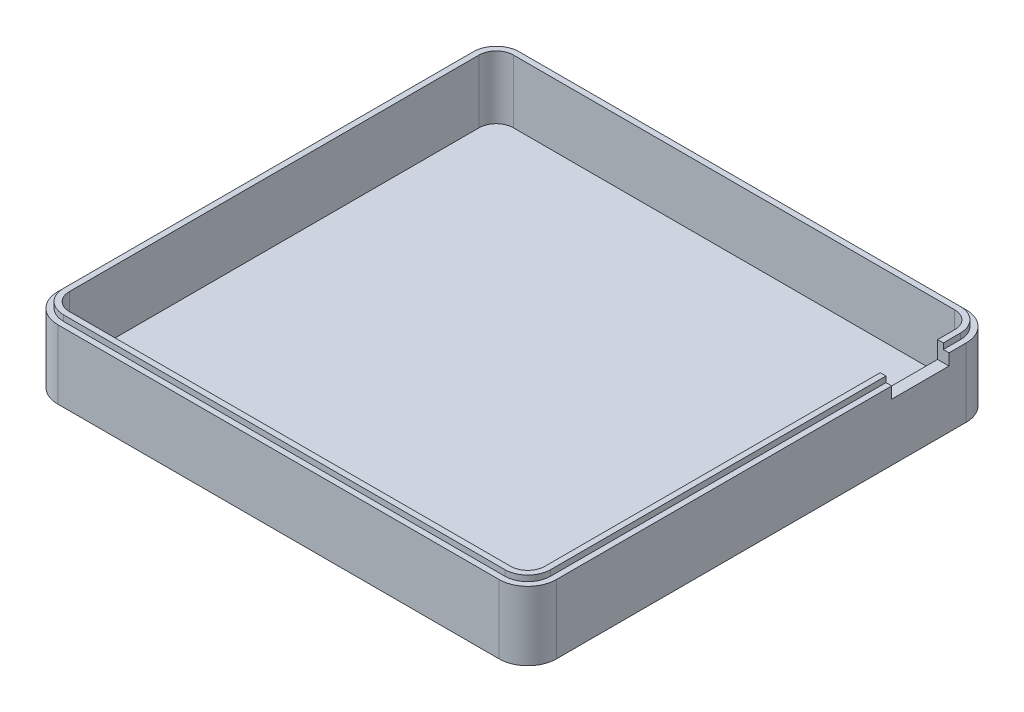
from build123d import *

# Parameters (mm, degrees)
EXTRUDE_4_DEPTH     = 2
EXTRUDE_5_DEPTH     = 12
EXTRUDE_START       = -12
EXTRUDE_7_DEPTH     = 1
CUT_EXTRUDE_START   = 2
CUT_EXTRUDE_4_DEPTH = 11
CUT_EXTRUDE_5_REACH = 119.533
SKETCH_4_W          = 10
SKETCH_4_H          = 5


with BuildPart() as part:
    # Эскиз1 → Бобышка-Вытянуть4 (new body)
    with BuildSketch(Plane(origin=(0, 0, 0), x_dir=(1, 0, 0), z_dir=(0, 1, 0))):
        with BuildLine():
            Line((-2.084374602, -1.449446306), (-2.084374602, -72.949446306))
            ThreePointArc((-2.084374602, -72.949446306), (-0.619908508, -76.484980212), (2.915625398, -77.949446306))
            Line((2.915625398, -77.949446306), (79.915625398, -77.949446306))
            ThreePointArc((79.915625398, -77.949446306), (83.451159304, -76.484980212), (84.915625398, -72.949446306))
            Line((84.915625398, -72.949446306), (84.915625398, -1.449446306))
            ThreePointArc((84.915625398, -1.449446306), (83.451159304, 2.0860876), (79.915625398, 3.550553694))
            Line((79.915625398, 3.550553694), (2.915625398, 3.550553694))
            ThreePointArc((2.915625398, 3.550553694), (-0.619908508, 2.0860876), (-2.084374602, -1.449446306))
        make_face()
    extrude(amount=EXTRUDE_4_DEPTH)

    # Эскиз1<9> → Бобышка-Вытянуть5 (add)
    with BuildSketch(Plane(origin=(0, 0, 0), x_dir=(1, 0, 0), z_dir=(0, 1, 0))):
        with BuildLine():
            Line((-2.084374602, -1.449446306), (-2.084374602, -72.949446306))
            ThreePointArc((-2.084374602, -72.949446306), (-0.619908508, -76.484980212), (2.915625398, -77.949446306))
            Line((2.915625398, -77.949446306), (79.915625398, -77.949446306))
            ThreePointArc((79.915625398, -77.949446306), (83.451159304, -76.484980212), (84.915625398, -72.949446306))
            Line((84.915625398, -72.949446306), (84.915625398, -1.449446306))
            ThreePointArc((84.915625398, -1.449446306), (83.451159304, 2.0860876), (79.915625398, 3.550553694))
            Line((79.915625398, 3.550553694), (2.915625398, 3.550553694))
            ThreePointArc((2.915625398, 3.550553694), (-0.619908508, 2.0860876), (-2.084374602, -1.449446306))
        make_face()
        with BuildLine():
            Line((-0.084374602, -1.449446306), (-0.084374602, -72.949446306))
            ThreePointArc((-0.084374602, -72.949446306), (0.794305055, -75.070766649), (2.915625398, -75.949446306))
            Line((2.915625398, -75.949446306), (79.915625398, -75.949446306))
            ThreePointArc((79.915625398, -75.949446306), (82.036945742, -75.070766649), (82.915625398, -72.949446306))
            Line((82.915625398, -72.949446306), (82.915625398, -1.449446306))
            ThreePointArc((82.915625398, -1.449446306), (82.036945742, 0.671874038), (79.915625398, 1.550553694))
            Line((79.915625398, 1.550553694), (2.915625398, 1.550553694))
            ThreePointArc((2.915625398, 1.550553694), (0.794305055, 0.671874038), (-0.084374602, -1.449446306))
        make_face(mode=Mode.SUBTRACT)
    extrude(amount=EXTRUDE_5_DEPTH)

    # Эскиз3 → Бобышка-Вытянуть7 (add)
    with BuildSketch(Plane.XZ.offset(EXTRUDE_START)):
        with BuildLine():
            Line((2.915625398, -2.550553694), (79.915625398, -2.550553694))
            ThreePointArc((79.915625398, -2.550553694), (82.744052523, -1.378980819), (83.915625398, 1.449446306))
            Line((83.915625398, 1.449446306), (83.915625398, 72.949446306))
            ThreePointArc((83.915625398, 72.949446306), (82.744052523, 75.777873431), (79.915625398, 76.949446306))
            Line((79.915625398, 76.949446306), (2.915625398, 76.949446306))
            ThreePointArc((2.915625398, 76.949446306), (0.087198273, 75.777873431), (-1.084374602, 72.949446306))
            Line((-1.084374602, 72.949446306), (-1.084374602, 1.449446306))
            ThreePointArc((-1.084374602, 1.449446306), (0.087198273, -1.378980819), (2.915625398, -2.550553694))
        make_face()
    extrude(amount=-EXTRUDE_7_DEPTH)

    # Эскиз1<13> → Вырез-Вытянуть4 (cut)
    with BuildSketch(Plane(origin=(0, 0, 0), x_dir=(1, 0, 0), z_dir=(0, 1, 0)).offset(CUT_EXTRUDE_START)):
        with BuildLine():
            Line((-0.084374602, -1.449446306), (-0.084374602, -72.949446306))
            ThreePointArc((-0.084374602, -72.949446306), (0.794305055, -75.070766649), (2.915625398, -75.949446306))
            Line((2.915625398, -75.949446306), (79.915625398, -75.949446306))
            ThreePointArc((79.915625398, -75.949446306), (82.036945742, -75.070766649), (82.915625398, -72.949446306))
            Line((82.915625398, -72.949446306), (82.915625398, -1.449446306))
            ThreePointArc((82.915625398, -1.449446306), (82.036945742, 0.671874038), (79.915625398, 1.550553694))
            Line((79.915625398, 1.550553694), (2.915625398, 1.550553694))
            ThreePointArc((2.915625398, 1.550553694), (0.794305055, 0.671874038), (-0.084374602, -1.449446306))
        make_face()
    extrude(amount=CUT_EXTRUDE_4_DEPTH, mode=Mode.SUBTRACT)

    # Эскиз4 → Вырез-Вытянуть5 (cut, up to next)
    with BuildSketch(Plane(origin=(84.915625398, 0, 0), x_dir=(0, 0, -1), z_dir=(1, 0, 0)), mode=Mode.PRIVATE) as cut_extrude_5_sk1:
        with Locations((-9.449446306, 12.5)):
            Rectangle(SKETCH_4_W, SKETCH_4_H)
    cut_extrude_5_tool1 = extrude(cut_extrude_5_sk1.sketch, amount=-CUT_EXTRUDE_5_REACH, mode=Mode.PRIVATE) & part.part
    add(cut_extrude_5_tool1.solids().sort_by_distance((84.915625, 12.5, 9.449446))[0], mode=Mode.SUBTRACT)


solid = part.part
